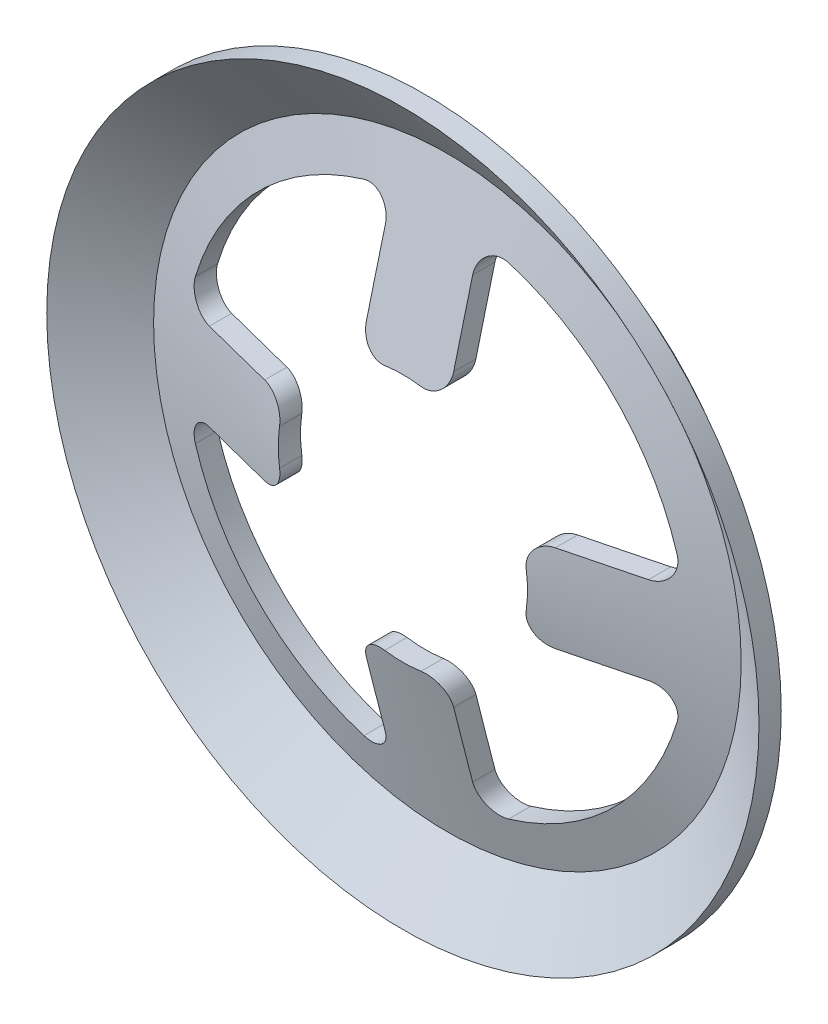
from build123d import *

# Parameters (mm, degrees)
CUT_EXTRUDE1_DEPTH       = 6.669270235
FILLET1_R                = 0.25
CIRPATTERN1_COUNT        = 4
FILLET1_OF_CIRPATTERN1_R = 0.25


with BuildPart() as part:
    # Sketch2 → Revolve1 (revolve)
    with BuildSketch(Plane(origin=(0, 0, 0), x_dir=(0, 0, -1), z_dir=(1, 0, 0))):
        Polygon((-0.375, 4), (0.125, 3.3), (-0.375, 1.4), (-0.125, 1.4), (0.375, 3.3), (-0.125, 4), align=None)
    revolve(axis=Axis((0, 0, 0.375), (0, 0, -1)))

    # Sketch3 → Cut-Extrude1 (cut, symmetric)
    with BuildSketch(Plane.XY):
        with BuildLine():
            Line((-0.490556102, 2.782081902), (-0.490556102, 0.490556102))
            Line((-0.490556102, 0.490556102), (-2.782081902, 0.490556102))
            ThreePointArc((-2.782081902, 0.490556102), (-1.997576657, 1.997576657), (-0.490556102, 2.782081902))
        make_face()
    cut_extrude1 = extrude(amount=CUT_EXTRUDE1_DEPTH, both=True, mode=Mode.SUBTRACT)

    # Fillet1
    fillet1_edges = [part.edges().sort_by_distance(p)[0] for p in [
        (-1.311241668, 0.490556102, 0.25),
        (-0.490556102, 1.311241668, 0.25),
        (-2.782081902, 0.490556102, -0.125),
        (-0.490556102, 2.782081902, -0.125),
    ]]
    fillet(fillet1_edges, radius=FILLET1_R)

    # CirPattern1: Cut-Extrude1 ×4 about axis
    cirpattern1_axis = Axis((0, 0, 0.375), (0, 0, 1))
    for i in range(1, CIRPATTERN1_COUNT):
        add(cut_extrude1.rotate(cirpattern1_axis, i * 360 / CIRPATTERN1_COUNT), mode=Mode.SUBTRACT)

    # Fillet1 of CirPattern1
    fillet1_of_cirpattern1_edges = [part.edges().sort_by_distance(p)[0] for p in [
        (-0.490556102, -1.311241668, 0.25),
        (-1.311241668, -0.490556102, 0.25),
        (-0.490556102, -2.782081902, -0.125),
        (-2.782081902, -0.490556102, -0.125),
        (1.311241668, -0.490556102, 0.25),
        (0.490556102, -1.311241668, 0.25),
        (2.782081902, -0.490556102, -0.125),
        (0.490556102, -2.782081902, -0.125),
        (0.490556102, 1.311241668, 0.25),
        (1.311241668, 0.490556102, 0.25),
        (0.490556102, 2.782081902, -0.125),
        (2.782081902, 0.490556102, -0.125),
    ]]
    fillet(fillet1_of_cirpattern1_edges, radius=FILLET1_OF_CIRPATTERN1_R)


solid = part.part
